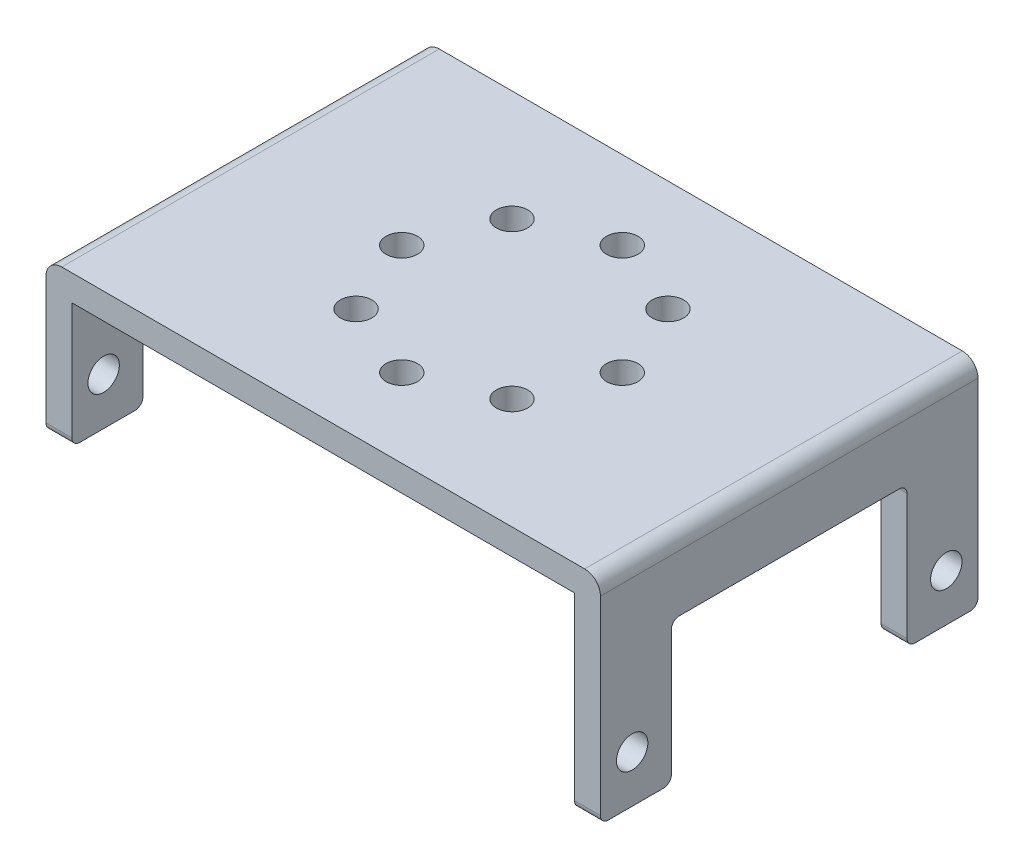
from build123d import *

# Parameters (mm, degrees)
SKETCH1_W           = 35.3
SKETCH1_H           = 24.04
SKETCH1_R           = 1
BOSS_EXTRUDE1_DEPTH = 1.65
SKETCH2_R           = 1
BOSS_EXTRUDE2_DEPTH = 1.65
SKETCH3_R           = 1
BOSS_EXTRUDE3_DEPTH = 1.65
FILLET1_R           = 1
FILLET2_R           = 1
FILLET3_R           = 0.5


with BuildPart() as part:
    # Sketch1 → Boss-Extrude1 (new body)
    with BuildSketch(Plane(origin=(0, 0, 0), x_dir=(1, 0, 0), z_dir=(0, 1, 0))):
        Rectangle(SKETCH1_W, SKETCH1_H)
        with Locations(Location((0, 7.02, 0), (0, 0, 270))):
            Circle(SKETCH1_R, mode=Mode.SUBTRACT)
        with Locations(Location((4.963889604, 4.963889604, 0), (0, 0, 270))):
            Circle(SKETCH1_R, mode=Mode.SUBTRACT)
        with Locations(Location((7.02, 0, 0), (0, 0, 270))):
            Circle(SKETCH1_R, mode=Mode.SUBTRACT)
        with Locations(Location((4.963889604, -4.963889604, 0), (0, 0, 270))):
            Circle(SKETCH1_R, mode=Mode.SUBTRACT)
        with Locations(Location((0, -7.02, 0), (0, 0, 270))):
            Circle(SKETCH1_R, mode=Mode.SUBTRACT)
        with Locations(Location((-4.963889604, -4.963889604, 0), (0, 0, 270))):
            Circle(SKETCH1_R, mode=Mode.SUBTRACT)
        with Locations(Location((-7.02, 0, 0), (0, 0, 270))):
            Circle(SKETCH1_R, mode=Mode.SUBTRACT)
        with Locations(Location((-4.963889604, 4.963889604, 0), (0, 0, 270))):
            Circle(SKETCH1_R, mode=Mode.SUBTRACT)
    extrude(amount=BOSS_EXTRUDE1_DEPTH)

    # Sketch2 → Boss-Extrude2 (add)
    # profile 1 of 2: a face of its own
    with BuildSketch(Plane(origin=(17.65, 0, 0), x_dir=(0, 0, -1), z_dir=(1, 0, 0))):
        Polygon((-7.5, -2.95), (0, -2.95), (0, 0), (-12.02, 0), (-12.02, -11.95), (-7.5, -11.95), align=None)
        with Locations((-10, -8.95)):
            Circle(SKETCH2_R, mode=Mode.SUBTRACT)
    # profile 2 of 2: a face of its own
    with BuildSketch(Plane(origin=(17.65, 0, 0), x_dir=(0, 0, -1), z_dir=(1, 0, 0))):
        Polygon((7.5, -2.95), (7.5, -11.95), (12.02, -11.95), (12.02, 0), (0, 0), (0, -2.95), align=None)
        with Locations((10, -8.95)):
            Circle(SKETCH2_R, mode=Mode.SUBTRACT)
    extrude(amount=-BOSS_EXTRUDE2_DEPTH)

    # Sketch3 → Boss-Extrude3 (add)
    # profile 1 of 2: a face of its own
    with BuildSketch(Plane.ZY.offset(17.65)):
        Polygon((-7.5, -2.95), (0, -2.95), (0, 0), (-12.02, 0), (-12.02, -7.95), (-7.5, -7.95), align=None)
        with Locations((-10, -4.95)):
            Circle(SKETCH3_R, mode=Mode.SUBTRACT)
    # profile 2 of 2: a face of its own
    with BuildSketch(Plane.ZY.offset(17.65)):
        Polygon((7.5, -2.95), (7.5, -7.95), (12.02, -7.95), (12.02, 0), (0, 0), (0, -2.95), align=None)
        with Locations((10, -4.95)):
            Circle(SKETCH3_R, mode=Mode.SUBTRACT)
    extrude(amount=-BOSS_EXTRUDE3_DEPTH)

    # Fillet1
    fillet1_edges = [part.edges().sort_by_distance(p)[0] for p in [
        (17.65, 1.65, 0),
    ]]
    fillet(fillet1_edges, radius=FILLET1_R)

    # Fillet2
    fillet2_edges = [part.edges().sort_by_distance(p)[0] for p in [
        (-17.65, 1.65, 0),
    ]]
    fillet(fillet2_edges, radius=FILLET2_R)

    # Fillet3
    fillet3_edges = [part.edges().sort_by_distance(p)[0] for p in [
        (16.825, -2.95, -7.5),
        (16.825, -2.95, 7.5),
        (16.825, -11.95, 7.5),
        (16.825, -11.95, 12.02),
        (16.825, -11.95, -12.02),
        (16.825, -11.95, -7.5),
        (-16.825, -2.95, 7.5),
        (-16.825, -2.95, -7.5),
        (-16.825, -7.95, -7.5),
        (-16.825, -7.95, -12.02),
        (-16.825, -7.95, 12.02),
        (-16.825, -7.95, 7.5),
    ]]
    fillet(fillet3_edges, radius=FILLET3_R)


solid = part.part
